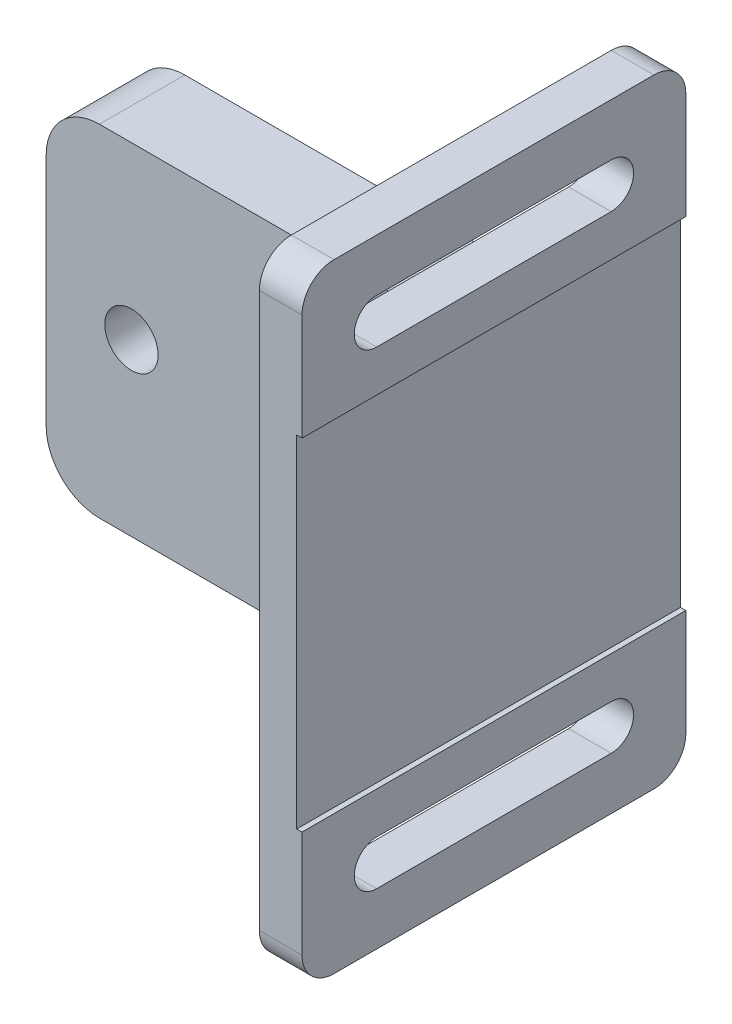
from build123d import *

# Parameters (mm, degrees)
SKETCH_1_W             = 40
SKETCH_1_H             = 58
EXTRUDE_2_DEPTH        = 36
SKETCH_2_W             = 36
SKETCH_2_H             = 13
CUT_EXTRUDE_1_DEPTH    = 36
SKETCH_3_W             = 16
SKETCH_3_H             = 32
CUT_EXTRUDE_2_DEPTH    = 36
CUT_EXTRUDE_3_DEPTH    = 5
HOLE_WIZARD_M6_1_D     = 5
HOLE_WIZARD_M6_1_DEPTH = 15
HOLE_WIZARD_M6_1_TIP   = 1.502151548
CUT_EXTRUDE_START      = -36
SKETCH_8_W             = 12
SKETCH_8_H             = 32
CUT_EXTRUDE_4_DEPTH    = 36
FILLET_1_R             = 3
FILLET_2_R             = 5
SKETCH_9_W             = 36
SKETCH_9_H             = 32
CUT_EXTRUDE_5_DEPTH    = 0.5


with BuildPart() as part:
    # 草图1 → 凸台-拉伸2 (new body)
    with BuildSketch(Plane.XY):
        with Locations((20, 29)):
            Rectangle(SKETCH_1_W, SKETCH_1_H)
    extrude(amount=EXTRUDE_2_DEPTH)

    # 草图2 → 切除-拉伸1 (cut)
    with BuildSketch(Plane.ZY):
        with Locations((18, 51.5)):
            Rectangle(SKETCH_2_W, SKETCH_2_H)
        with Locations((18, 6.5)):
            Rectangle(SKETCH_2_W, SKETCH_2_H)
    extrude(amount=-CUT_EXTRUDE_1_DEPTH, mode=Mode.SUBTRACT)

    # 草图3 → 切除-拉伸2 (cut)
    with BuildSketch(Plane.ZY):
        with Locations((28, 29)):
            Rectangle(SKETCH_3_W, SKETCH_3_H)
    extrude(amount=-CUT_EXTRUDE_2_DEPTH, mode=Mode.SUBTRACT)

    # 草图4 → 切除-拉伸3 (cut)
    with BuildSketch(Plane(origin=(40, 0, 0), x_dir=(0, 0, -1), z_dir=(1, 0, 0))):
        with BuildLine():
            Line((-29, 53.1), (-7, 53.1))
            ThreePointArc((-7, 53.1), (-4.9, 51), (-7, 48.9))
            Line((-7, 48.9), (-29, 48.9))
            ThreePointArc((-29, 48.9), (-31.1, 51), (-29, 53.1))
        make_face()
        with BuildLine():
            Line((-29, 9.1), (-7, 9.1))
            ThreePointArc((-7, 9.1), (-4.9, 7), (-7, 4.9))
            Line((-7, 4.9), (-29, 4.9))
            ThreePointArc((-29, 4.9), (-31.1, 7), (-29, 9.1))
        make_face()
    extrude(amount=-CUT_EXTRUDE_3_DEPTH, mode=Mode.SUBTRACT)

    # M6 螺纹孔1
    with Locations(Plane.XY.offset(20)):
        with Locations((26, 29), (8, 29)):
            Hole(HOLE_WIZARD_M6_1_D / 2, depth=HOLE_WIZARD_M6_1_DEPTH)
            with Locations((0, 0, -(HOLE_WIZARD_M6_1_DEPTH + HOLE_WIZARD_M6_1_TIP / 2))):  # 118° drill point
                Cone(0, HOLE_WIZARD_M6_1_D / 2, HOLE_WIZARD_M6_1_TIP, mode=Mode.SUBTRACT)

    # 草图8 → 切除-拉伸4 (cut)
    with BuildSketch(Plane.ZY.offset(CUT_EXTRUDE_START)):
        with Locations((6, 29)):
            Rectangle(SKETCH_8_W, SKETCH_8_H)
    extrude(amount=CUT_EXTRUDE_4_DEPTH, mode=Mode.SUBTRACT)

    # 圆角1
    fillet_1_edges = [part.edges().sort_by_distance(p)[0] for p in [
        (38, 58, 36),
        (38, 0, 0),
        (38, 0, 36),
        (38, 58, 0),
    ]]
    fillet(fillet_1_edges, radius=FILLET_1_R)

    # 圆角2
    fillet_2_edges = [part.edges().sort_by_distance(p)[0] for p in [
        (0, 45, 16),
        (0, 13, 16),
    ]]
    fillet(fillet_2_edges, radius=FILLET_2_R)

    # 草图9 → 切除-拉伸5 (cut)
    with BuildSketch(Plane(origin=(40, 0, 0), x_dir=(0, 0, -1), z_dir=(1, 0, 0))):
        with Locations((-18, 29)):
            Rectangle(SKETCH_9_W, SKETCH_9_H)
    extrude(amount=-CUT_EXTRUDE_5_DEPTH, mode=Mode.SUBTRACT)


solid = part.part
